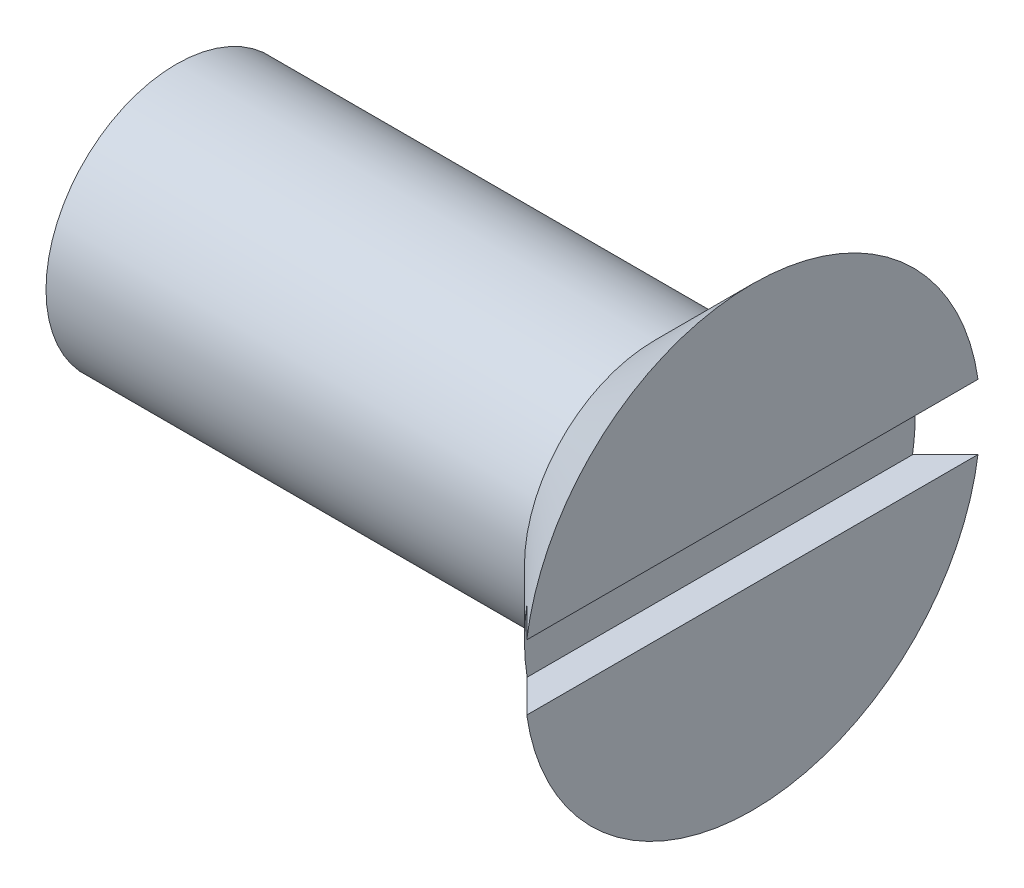
from build123d import *

# Parameters (mm, degrees)
SKETCH2_W          = 14
SKETCH2_H          = 2
CUT_EXTRUDE1_DEPTH = 1


with BuildPart() as part:
    # Sketch1 → Revolve1 (revolve)
    with BuildSketch(Plane.XY, mode=Mode.PRIVATE) as revolve1_sk:
        Polygon((0, 0), (-20, 0), (-17.690598923, -4), (-3, -4), (0, -7), align=None)
    revolve(revolve1_sk.sketch.rotate(Axis((0, 0, 0), (-1, 0, 0)), 270), axis=Axis((0, 0, 0), (-1, 0, 0)))

    # Sketch2 → Cut-Extrude1 (cut)
    with BuildSketch(Plane(origin=(0, 0, 0), x_dir=(0, 0, -1), z_dir=(1, 0, 0))):
        Rectangle(SKETCH2_W, SKETCH2_H)
    extrude(amount=-CUT_EXTRUDE1_DEPTH, mode=Mode.SUBTRACT)


solid = part.part
